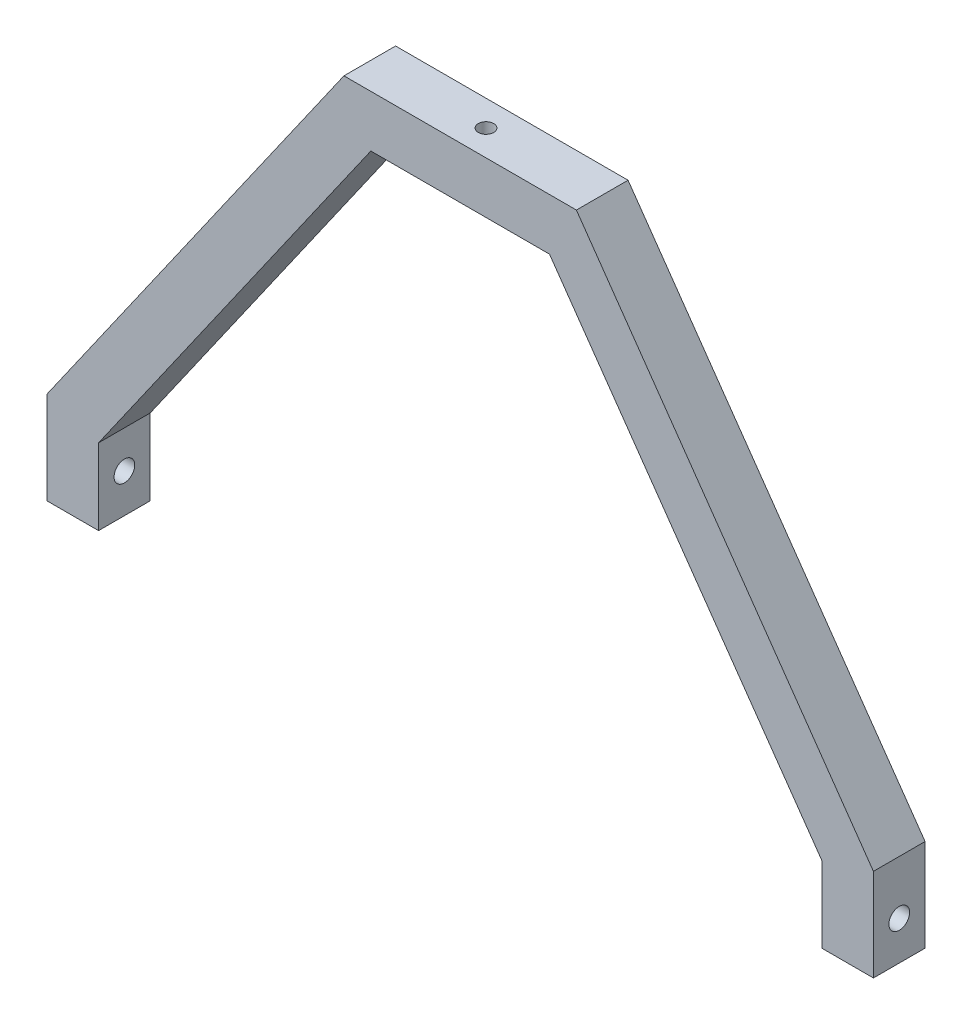
from build123d import *

# Parameters (mm, degrees)
BOSS_EXTRUDE1_DEPTH = 20
CUT_EXTRUDE1_REACH  = 374.693
SKETCH2_R           = 4
CUT_EXTRUDE2_DEPTH  = 20


with BuildPart() as part:
    # Sketch1 → Boss-Extrude1 (new body)
    with BuildSketch(Plane.XY):
        Polygon((0, -10), (34.588658989, -10), (140, -160.542996553), (140, -190), (160, -190), (160, -154.237020775), (45, 10), (0, 10), (-45, 10), (-160, -154.237020775), (-160, -190), (-140, -190), (-140, -160.542996553), (-34.588658989, -10), align=None)
    extrude(amount=BOSS_EXTRUDE1_DEPTH)

    # Cut-Extrude1: up to this face of the body (flat: up to its plane)
    cut_extrude1_end = Plane(part.part.faces().sort_by_distance((-160, -172.118510388, 10))[0])
    # Sketch2 → Cut-Extrude1 (cut, up to the picked face)
    with BuildSketch(Plane(origin=(160, 0, 0), x_dir=(0, 0, -1), z_dir=(1, 0, 0)), mode=Mode.PRIVATE) as cut_extrude1_sk1:
        with Locations(Location((-10, -175, 0), (0, 0, 90))):
            Circle(SKETCH2_R)
    cut_extrude1_tool1 = split(extrude(cut_extrude1_sk1.sketch, amount=-CUT_EXTRUDE1_REACH, mode=Mode.PRIVATE), bisect_by=cut_extrude1_end, keep=Keep.BOTH, mode=Mode.PRIVATE)
    add(cut_extrude1_tool1.solids().sort_by(Axis((160, -175, 10), (-1, 0, 0)))[0], mode=Mode.SUBTRACT)

    # Sketch3 → Cut-Extrude2 (cut)
    with BuildSketch(Plane(origin=(0, 10, 0), x_dir=(1, 0, 0), z_dir=(0, 1, 0))):
        with BuildLine():
            ThreePointArc((3, -10), (2.121320344, -7.878679656), (0, -7))
            Line((0, -7), (0, -10))
            Line((0, -10), (3, -10))
        make_face()
        with BuildLine():
            Line((0, -10), (0, -7))
            ThreePointArc((0, -7), (-2.121320344, -7.878679656), (-3, -10))
            Line((-3, -10), (0, -10))
        make_face()
        with BuildLine():
            Line((3, -10), (0, -10))
            Line((0, -10), (0, -13))
            ThreePointArc((0, -13), (2.121320344, -12.121320344), (3, -10))
        make_face()
        with BuildLine():
            Line((0, -13), (0, -10))
            Line((0, -10), (-3, -10))
            ThreePointArc((-3, -10), (-2.121320344, -12.121320344), (0, -13))
        make_face()
    extrude(amount=-CUT_EXTRUDE2_DEPTH, mode=Mode.SUBTRACT)


solid = part.part
